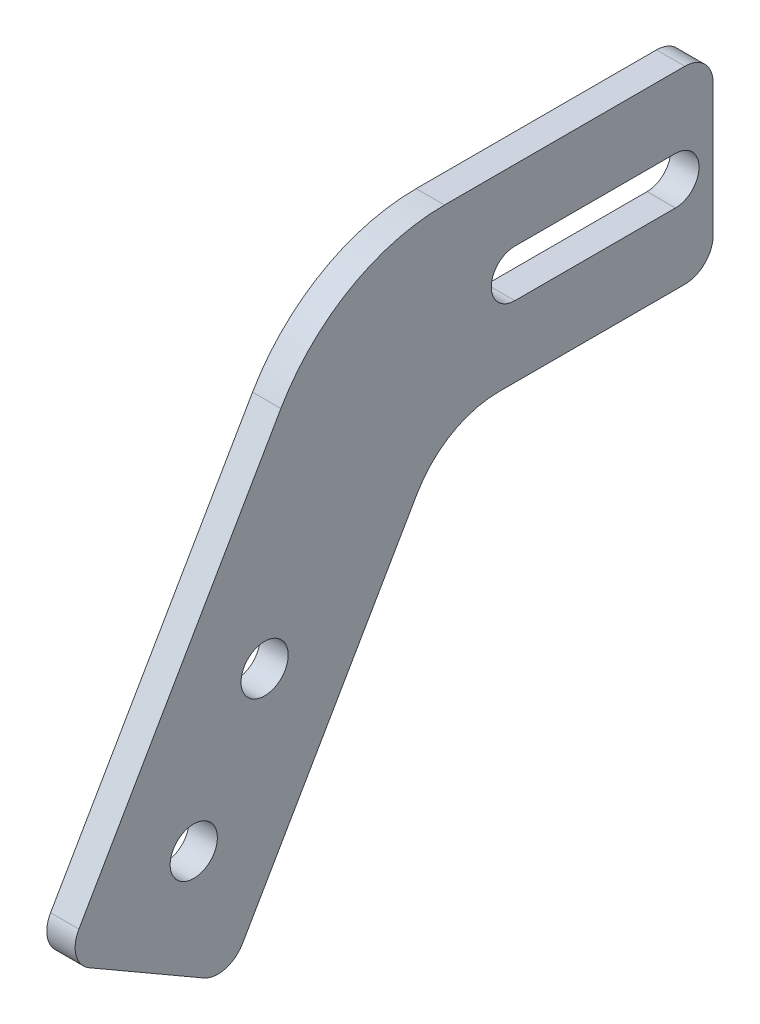
from build123d import *

# Parameters (mm, degrees)
SKETCH1_R           = 2.5
BOSS_EXTRUDE1_DEPTH = 3
FILLET1_R           = 3


with BuildPart() as part:
    # Sketch1 → Boss-Extrude1 (new body)
    with BuildSketch(Plane(origin=(0, 0, 0), x_dir=(0, 0, -1), z_dir=(1, 0, 0))):
        with BuildLine():
            Line((17.320508076, 0), (40, 0))
            Line((40, 0), (40, 20))
            Line((40, 20), (11.547005384, 20))
            ThreePointArc((11.547005384, 20), (1.547005384, 17.320508076), (-5.773502692, 10))
            Line((-5.773502692, 10), (-28.660254038, -29.641016151))
            Line((-28.660254038, -29.641016151), (-11.339745962, -39.641016151))
            Line((-11.339745962, -39.641016151), (8.660254038, -5))
            ThreePointArc((8.660254038, -5), (12.320508076, -1.339745962), (17.320508076, 0))
        make_face()
        with Locations((-15, -25.980762114)):
            Circle(SKETCH1_R, mode=Mode.SUBTRACT)
        with Locations((-7.5, -12.990381057)):
            Circle(SKETCH1_R, mode=Mode.SUBTRACT)
        with BuildLine():
            Line((19, 12.5), (36, 12.5))
            ThreePointArc((36, 12.5), (38.5, 10), (36, 7.5))
            Line((36, 7.5), (19, 7.5))
            ThreePointArc((19, 7.5), (16.5, 10), (19, 12.5))
        make_face(mode=Mode.SUBTRACT)
    extrude(amount=BOSS_EXTRUDE1_DEPTH)

    # Fillet1
    fillet1_edges = [part.edges().sort_by_distance(p)[0] for p in [
        (1.5, 0, -40),
        (1.5, -39.641016151, 11.339745962),
        (1.5, -29.641016151, 28.660254038),
        (1.5, 20, -40),
    ]]
    fillet(fillet1_edges, radius=FILLET1_R)


solid = part.part
